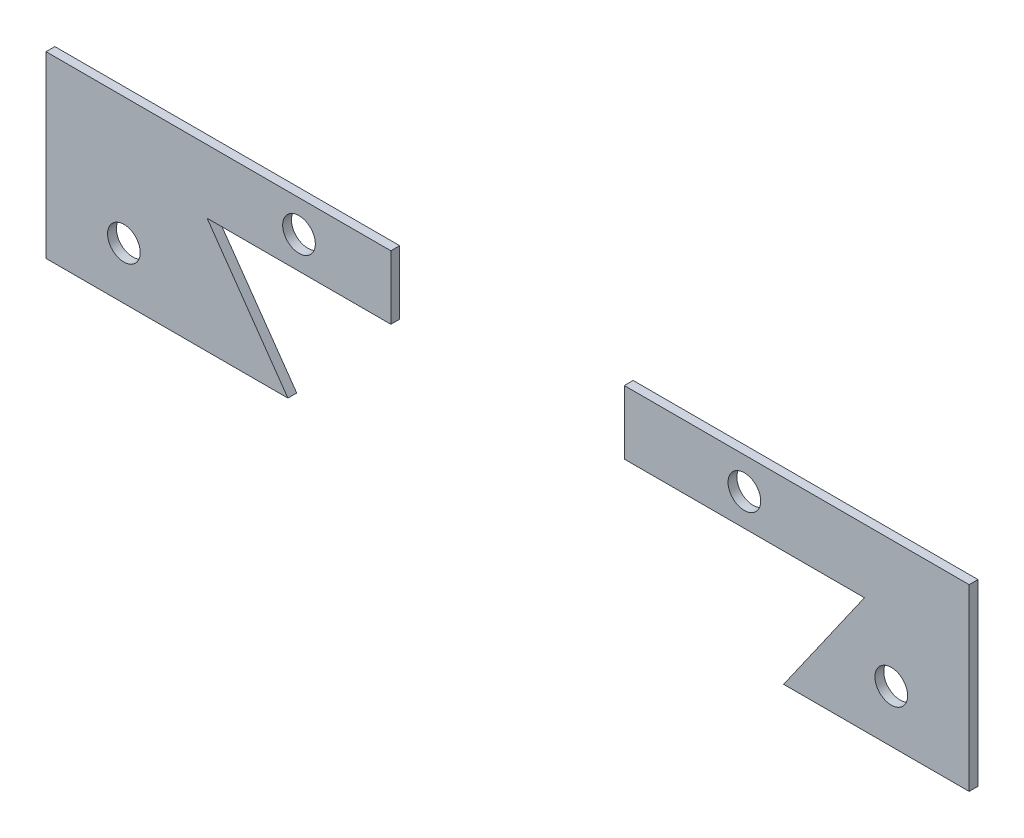
from build123d import *

# Parameters (mm, degrees)
BOSS_EXTRUDE1_DEPTH            = 1.21412
BOSS_EXTRUDE1_2_DEPTH          = 1.21412
SKETCH3_W                      = 2.2479
SKETCH3_H                      = 1.21412
F_8_CLEARANCE_HOLE1_AT_2_COUNT = 2
F_8_CLEARANCE_HOLE1_AT_2_PITCH = 27.409736217
F_8_CLEARANCE_HOLE1_AT_3_COUNT = 2
F_8_CLEARANCE_HOLE1_AT_3_PITCH = 86.352641558
F_8_CLEARANCE_HOLE1_AT_4_COUNT = 2
F_8_CLEARANCE_HOLE1_AT_4_PITCH = 105.567102665


with BuildPart() as part:
    # Sketch1 → Boss-Extrude1 (new body)
    with BuildSketch(Plane.XY):
        Polygon((0, 25.4), (47.443663681, 25.4), (47.443663681, 16.637), (22.163130258, 16.637), (33.278924927, 0.762), (0, 0.762), align=None)
    extrude(amount=BOSS_EXTRUDE1_DEPTH)

    # Sketch3 → #8 Clearance Hole1 (revolve, cut)
    with BuildSketch(Plane(origin=(10.716448667, 7.9375, 1.21412), x_dir=(0, -1, 0), z_dir=(1, 0, 0))):
        with Locations((1.12395, 0.60706)):
            Rectangle(SKETCH3_W, SKETCH3_H)
    f_8_clearance_hole1 = revolve(axis=Axis((10.716448667, 7.9375, 7.56412), (0, 0, -1)), mode=Mode.SUBTRACT)

    # #8 Clearance Hole1 at 2: #8 Clearance Hole1 ×2
    with Locations(*[Vector(0.8787734442616352, 0.4772391786730663, 0) * (i * F_8_CLEARANCE_HOLE1_AT_2_PITCH) for i in range(1, F_8_CLEARANCE_HOLE1_AT_2_COUNT)]):
        add(f_8_clearance_hole1, mode=Mode.SUBTRACT)


with BuildPart() as body_2:
    # Sketch1 → Boss-Extrude1 2 (new body)
    with BuildSketch(Plane.XY):
        Polygon((79.556336319, 25.4), (127, 25.4), (127, 0.762), (101.472993712, 0.762), (112.588788381, 16.637), (79.556336319, 16.637), align=None)
    extrude(amount=BOSS_EXTRUDE1_2_DEPTH)

    # #8 Clearance Hole1 at 3: #8 Clearance Hole1 ×2
    with Locations(*[Vector(0.9884597870181576, 0.1514834956291232, 0) * (i * F_8_CLEARANCE_HOLE1_AT_3_PITCH) for i in range(1, F_8_CLEARANCE_HOLE1_AT_3_COUNT)]):
        add(f_8_clearance_hole1, mode=Mode.SUBTRACT)

    # #8 Clearance Hole1 at 4: #8 Clearance Hole1 ×2
    with Locations(*[(i * F_8_CLEARANCE_HOLE1_AT_4_PITCH, 0, 0) for i in range(1, F_8_CLEARANCE_HOLE1_AT_4_COUNT)]):
        add(f_8_clearance_hole1, mode=Mode.SUBTRACT)


solid = Compound([part.part, body_2.part])
